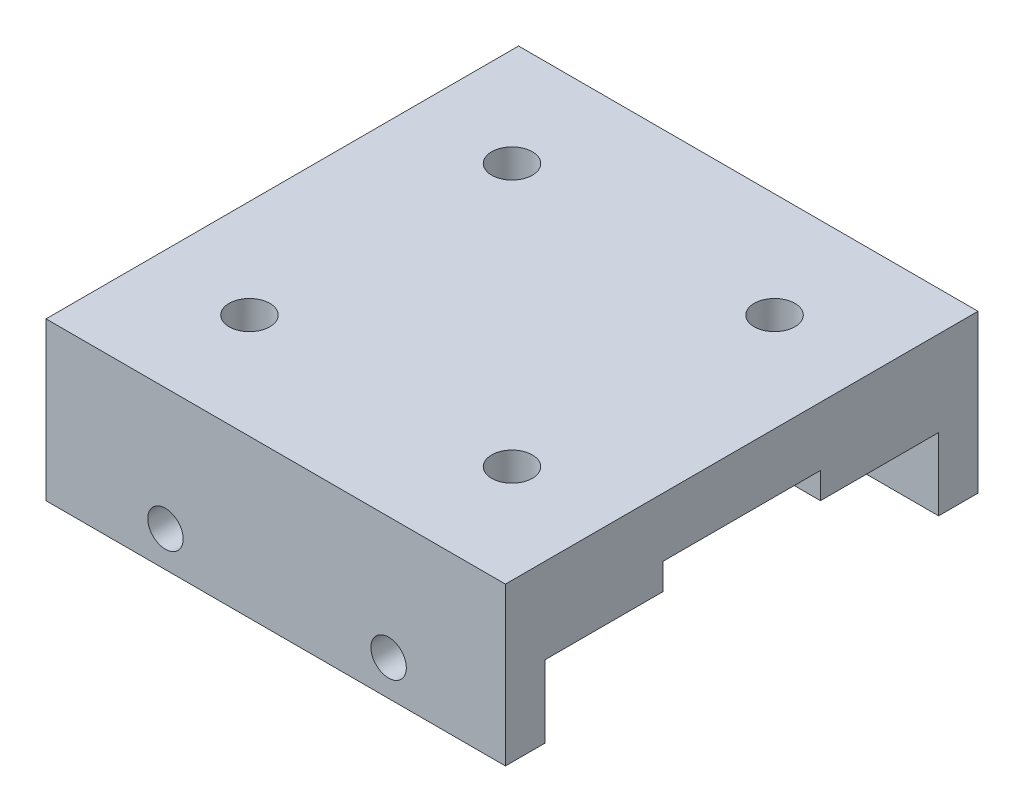
from build123d import *

# Parameters (mm, degrees)
BOSS_EXTRUDE1_DEPTH        = 18
CROQUIS2_R                 = 1.35
CORTAR_EXTRUIR2_DEPTH      = 5
CORTAR_EXTRUIR3_START      = 3
CORTAR_EXTRUIR3_DEPTH      = 17
CORTAR_EXTRUIR4_DEPTH      = 33.203415968
CORTAR_EXTRUIR4_DEPTH_BACK = 2
CROQUIS4_W                 = 70
CROQUIS4_H                 = 12
CORTAR_EXTRUIR5_DEPTH      = 2.5
CORTAR_EXTRUIR5_DEPTH_BACK = 3
CROQUIS7_R                 = 0.161098749
CROQUIS7_R_2               = 1.55
CORTAR_EXTRUIR6_DEPTH      = 33.203415968


with BuildPart() as part:
    # Sketch1 → Boss-Extrude1 (new body)
    with BuildSketch(Plane.XY):
        Polygon((25.9, 9.3), (-9.1, 9.3), (-9.1, 2.5), (-9.1, -2.7), (25.9, -2.7), (25.9, 2.5), align=None)
    boss_extrude1 = extrude(amount=BOSS_EXTRUDE1_DEPTH)

    # Croquis2 → Cortar-Extruir2 (cut)
    with BuildSketch(Plane.XY.offset(18)):
        Circle(CROQUIS2_R)
        with Locations((17, 0)):
            Circle(CROQUIS2_R)
    cortar_extruir2 = extrude(amount=-CORTAR_EXTRUIR2_DEPTH, mode=Mode.SUBTRACT)

    # Croquis3 → Cortar-Extruir3 (cut)
    with BuildSketch(Plane(origin=(0, 0, 18), x_dir=(-1, 0, 0), z_dir=(0, 0, -1)).offset(CORTAR_EXTRUIR3_START)):
        Polygon((-25.9, -2.7), (-25.9, 2.8), (4.1, 2.8), (9.1, -2.2), (9.1, -2.7), align=None)
    cortar_extruir3 = extrude(amount=CORTAR_EXTRUIR3_DEPTH, mode=Mode.SUBTRACT)

    # Mirror1: Boss-Extrude1, Cortar-Extruir2, Cortar-Extruir3 across plane
    add(boss_extrude1.mirror(Plane.XY))
    add(cortar_extruir2.mirror(Plane.XY), mode=Mode.SUBTRACT)
    add(cortar_extruir3.mirror(Plane.XY), mode=Mode.SUBTRACT)

    # Croquis4 → Cortar-Extruir4 (cut, two sides: drawn at the far end of the back side and taken through both)
    with BuildSketch(Plane.XZ.offset(-2.8).offset(-CORTAR_EXTRUIR4_DEPTH_BACK)):
        with Locations((-9.1, 0)):
            Rectangle(CROQUIS4_W, CROQUIS4_H)
    extrude(amount=CORTAR_EXTRUIR4_DEPTH + CORTAR_EXTRUIR4_DEPTH_BACK, mode=Mode.SUBTRACT)

    # Croquis5 → Cortar-Extruir5 (cut, two sides: drawn at the far end of the back side and taken through both)
    with BuildSketch(Plane.XZ.offset(-2.8).offset(-CORTAR_EXTRUIR5_DEPTH_BACK)):
        Polygon((-1.6, 13.175426481), (-4.35, 11.58771324), (-4.35, 8.41228676), (-1.6, 6.824573519), (1.15, 8.41228676), (1.15, 11.58771324), align=None)
        Polygon((18.4, 13.175426481), (15.65, 11.58771324), (15.65, 8.41228676), (18.4, 6.824573519), (21.15, 8.41228676), (21.15, 11.58771324), align=None)
        Polygon((-1.6, -6.824573519), (-4.35, -8.41228676), (-4.35, -11.58771324), (-1.6, -13.175426481), (1.15, -11.58771324), (1.15, -8.41228676), align=None)
        Polygon((18.4, -6.824573519), (15.65, -8.41228676), (15.65, -11.58771324), (18.4, -13.175426481), (21.15, -11.58771324), (21.15, -8.41228676), align=None)
    extrude(amount=CORTAR_EXTRUIR5_DEPTH + CORTAR_EXTRUIR5_DEPTH_BACK, mode=Mode.SUBTRACT)

    # Croquis7 → Cortar-Extruir6 (cut, through all)
    with BuildSketch(Plane.XZ.offset(-2.8)):
        with Locations((-69.565345843, 7.024441215)):
            Circle(CROQUIS7_R)
        with Locations((-1.6, 10)):
            Circle(CROQUIS7_R_2)
        with Locations((18.4, 10)):
            Circle(CROQUIS7_R_2)
        with Locations((18.4, -10)):
            Circle(CROQUIS7_R_2)
        with Locations((-1.6, -10)):
            Circle(CROQUIS7_R_2)
    extrude(amount=-CORTAR_EXTRUIR6_DEPTH, mode=Mode.SUBTRACT)


solid = part.part
